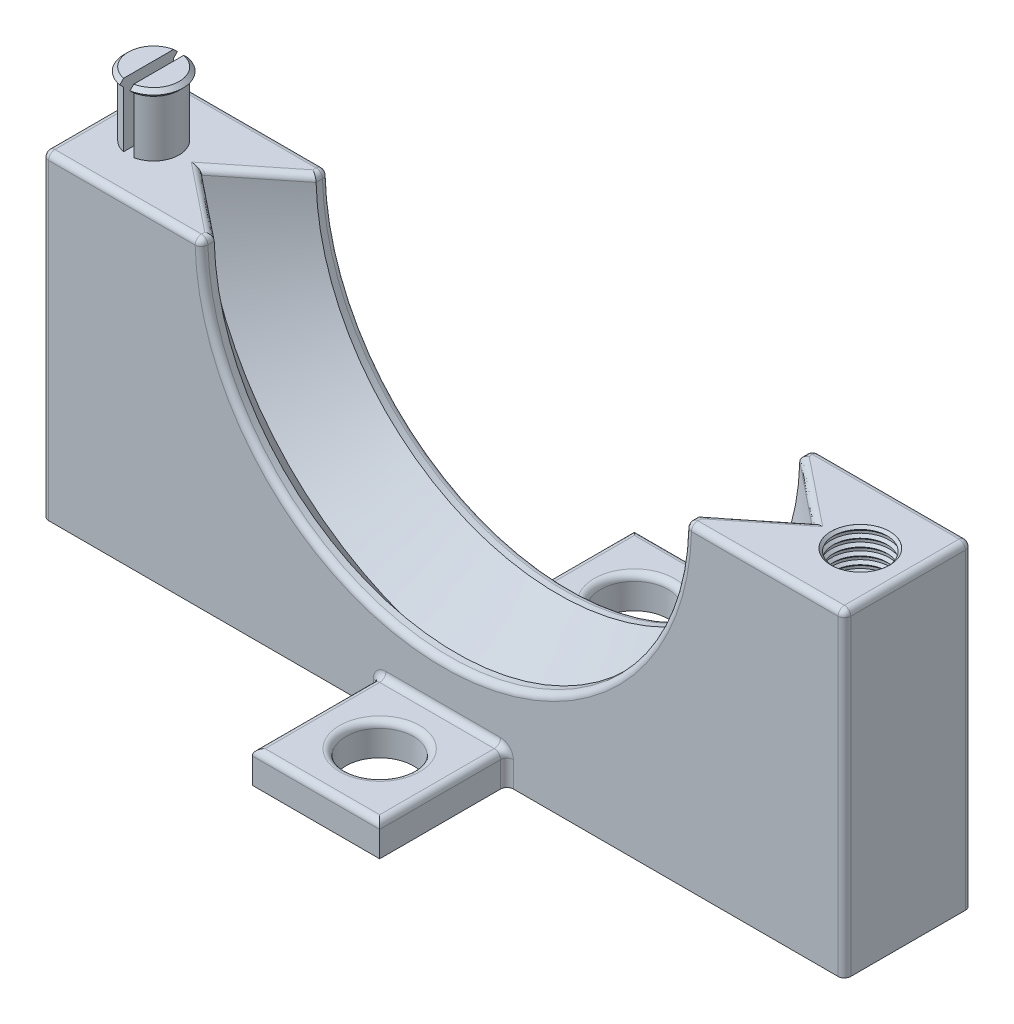
from build123d import *

# Parameters (mm, degrees)
BOSS_EXTRUDE1_DEPTH = 12.7
SKETCH6_R           = 2.921
CUT_EXTRUDE2_DEPTH  = 9.525
CUT_EXTRUDE3_REACH  = 58.686
SKETCH16_W          = 1.016
SKETCH16_H          = 11.1836739
SKETCH17_W          = 12.7
SKETCH17_H          = 12.7
BOSS_EXTRUDE2_DEPTH = 3.175
SKETCH18_R          = 3.3655
CUT_EXTRUDE4_DEPTH  = 59.866931719
FILLET1_R           = 0.635


with BuildPart() as part:
    # Sketch1 → Boss-Extrude1 (new body)
    with BuildSketch(Plane.XY):
        with BuildLine():
            Line((-40.005, 0), (40.005, 0))
            Line((40.005, 0), (40.005, 31.75))
            Line((40.005, 31.75), (24.13, 31.75))
            ThreePointArc((24.13, 31.75), (0, 7.62), (-24.13, 31.75))
            Line((-24.13, 31.75), (-40.005, 31.75))
            Line((-40.005, 31.75), (-40.005, 0))
        make_face()
    extrude(amount=BOSS_EXTRUDE1_DEPTH)

    # Sketch2 → Cut-Revolve1 (revolve, cut)
    with BuildSketch(Plane(origin=(0, 31.75, 0), x_dir=(1, 0, 0), z_dir=(0, 1, 0))):
        Polygon((24.13, -11.43), (30.48, -6.35), (24.13, -1.27), align=None)
    revolve(axis=Axis((0, 31.75, 0), (0, 0, 1)), mode=Mode.SUBTRACT)

    # Sketch6 → Cut-Extrude2 (cut)
    with BuildSketch(Plane(origin=(0, 31.75, 0), x_dir=(1, 0, 0), z_dir=(0, 1, 0))):
        with Locations(Location((35.2425, -6.35, 0), (0, 0, 180))):
            Circle(SKETCH6_R)
    extrude(amount=-CUT_EXTRUDE2_DEPTH, mode=Mode.SUBTRACT)

    # Sketch15 → Revolve2 (revolve)
    with BuildSketch(Plane.XY.offset(6.35), mode=Mode.PRIVATE) as revolve2_sk:
        Polygon((-37.7825, 31.75), (-37.7825, 37.338), (-38.1635, 37.719), (-37.7825, 38.1), (-35.2425, 38.1), (-35.2425, 31.75), align=None)
    revolve(revolve2_sk.sketch.rotate(Axis((-35.2425, 38.1, 6.35), (0, -1, 0)), 270), axis=Axis((-35.2425, 38.1, 6.35), (0, -1, 0)))

    # Cut-Extrude3: up to this face of the body (flat: up to its plane)
    cut_extrude3_end = Plane(part.part.faces().sort_by_distance((-32.0675, 31.75, 0.203299195))[0])
    # Sketch16 → Cut-Extrude3 (cut, up to the picked face)
    with BuildSketch(Plane(origin=(0, 38.1, 0), x_dir=(1, 0, 0), z_dir=(0, 1, 0)), mode=Mode.PRIVATE) as cut_extrude3_sk1:
        with Locations((-35.2425, -6.35)):
            Rectangle(SKETCH16_W, SKETCH16_H)
    cut_extrude3_tool1 = split(extrude(cut_extrude3_sk1.sketch, amount=-CUT_EXTRUDE3_REACH, mode=Mode.PRIVATE), bisect_by=cut_extrude3_end, keep=Keep.BOTH, mode=Mode.PRIVATE)
    add(cut_extrude3_tool1.solids().sort_by(Axis((-35.2425, 38.1, 6.35), (0, -1, 0)))[0], mode=Mode.SUBTRACT)

    # Sketch17 → Boss-Extrude2 (add)
    with BuildSketch(Plane(origin=(0, 0, 0), x_dir=(-1, 0, 0), z_dir=(0, -1, 0))):
        with Locations((0, -19.05)):
            Rectangle(SKETCH17_W, SKETCH17_H)
        with Locations((0, 6.35)):
            Rectangle(SKETCH17_W, SKETCH17_H)
    extrude(amount=-BOSS_EXTRUDE2_DEPTH)

    # Sketch18 → Cut-Extrude4 (cut, through all)
    with BuildSketch(Plane(origin=(0, 3.175, 0), x_dir=(1, 0, 0), z_dir=(0, 1, 0))):
        with Locations(Location((0, -19.05, 0), (0, 0, 270))):
            Circle(SKETCH18_R)
        with Locations(Location((0, 6.35, 0), (0, 0, 270))):
            Circle(SKETCH18_R)
    extrude(amount=-CUT_EXTRUDE4_DEPTH, mode=Mode.SUBTRACT)

    # Fillet1
    fillet1_edges = [part.edges().sort_by_distance(p)[0] for p in [
        (6.35, 1.5875, 0),
        (-6.35, 1.5875, 0),
        (6.35, 3.175, -6.35),
        (0, 3.175, 25.4),
        (-6.35, 3.175, -6.35),
        (0, 3.175, 12.7),
        (0, 3.175, 15.6845),
        (0, 3.175, -12.7),
        (0, 3.175, 0),
        (0, 3.175, -9.7155),
        (40.005, 15.875, 0),
        (40.005, 15.875, 12.7),
        (0, 7.62, 0),
        (-24.13, 31.75, 0.635),
        (-24.13, 31.75, 12.065),
        (24.13, 31.75, 12.065),
        (24.13, 31.75, 0.635),
        (27.305, 31.75, 3.81),
        (27.305, 31.75, 8.89),
        (32.0675, 31.75, 12.7),
        (40.005, 31.75, 6.35),
        (32.0675, 31.75, 0),
        (-32.0675, 31.75, 0),
        (-27.305, 31.75, 3.81),
        (-27.305, 31.75, 8.89),
        (0, 7.62, 12.7),
        (-32.0675, 31.75, 12.7),
        (-40.005, 15.875, 12.7),
        (-40.005, 31.75, 6.35),
        (-40.005, 15.875, 0),
        (-6.35, 1.5875, 12.7),
        (6.35, 1.5875, 12.7),
        (-6.35, 3.175, 19.05),
        (6.35, 3.175, 19.05),
    ]]
    fillet(fillet1_edges, radius=FILLET1_R)


with BuildPart() as body_2:
    # Sketch12 → Revolve1 (revolve)
    with BuildSketch(Plane.XY.offset(6.35), mode=Mode.PRIVATE) as revolve1_sk:
        Polygon((32.3215, 30.48), (32.5755, 30.734), (32.3215, 30.988), align=None)
        Polygon((32.3215, 31.242), (32.5755, 31.496), (32.3215, 31.75), align=None)
        Polygon((32.3215, 29.718), (32.5755, 29.972), (32.3215, 30.226), align=None)
        Polygon((32.3215, 28.956), (32.5755, 29.21), (32.3215, 29.464), align=None)
        Polygon((32.3215, 28.194), (32.5755, 28.448), (32.3215, 28.702), align=None)
        Polygon((32.3215, 27.432), (32.5755, 27.686), (32.3215, 27.94), align=None)
        Polygon((32.3215, 26.67), (32.5755, 26.924), (32.3215, 27.178), align=None)
        Polygon((32.3215, 25.908), (32.5755, 26.162), (32.3215, 26.416), align=None)
        Polygon((32.3215, 25.146), (32.5755, 25.4), (32.3215, 25.654), align=None)
        Polygon((32.3215, 24.384), (32.5755, 24.638), (32.3215, 24.892), align=None)
        Polygon((32.3215, 23.622), (32.5755, 23.876), (32.3215, 24.13), align=None)
        Polygon((32.3215, 22.86), (32.5755, 23.114), (32.3215, 23.368), align=None)
        Polygon((32.3215, 22.098), (32.5755, 22.352), (32.3215, 22.606), align=None)
        Polygon((32.3215, 21.336), (32.5755, 21.59), (32.3215, 21.844), align=None)
        Polygon((32.3215, 20.574), (32.5755, 20.828), (32.3215, 21.082), align=None)
        Polygon((32.3215, 19.812), (32.5755, 20.066), (32.3215, 20.32), align=None)
        Polygon((32.3215, 19.05), (32.5755, 19.304), (32.3215, 19.558), align=None)
        Polygon((32.3215, 18.288), (32.5755, 18.542), (32.3215, 18.796), align=None)
        Polygon((32.3215, 17.526), (32.5755, 17.78), (32.3215, 18.034), align=None)
        Polygon((32.3215, 16.764), (32.5755, 17.018), (32.3215, 17.272), align=None)
    revolve(revolve1_sk.sketch.rotate(Axis((35.2425, 31.75, 6.35), (0, -1, 0)), 270), axis=Axis((35.2425, 31.75, 6.35), (0, -1, 0)))


solid = Compound([part.part, body_2.part])
